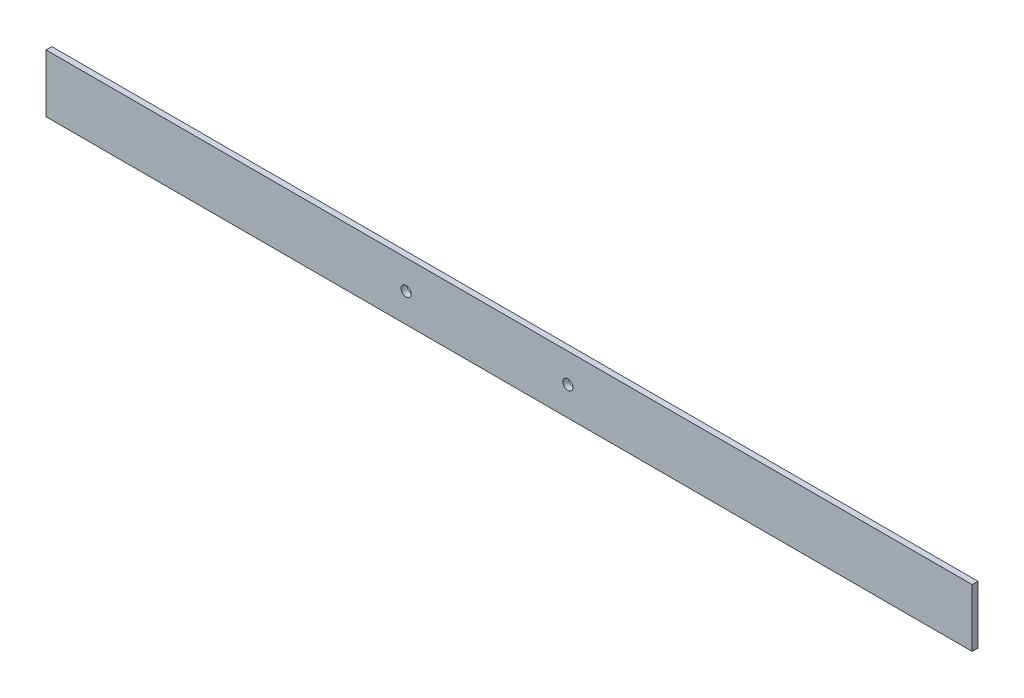
from build123d import *

# Parameters (mm, degrees)
SZKIC1_W                    = 400
SZKIC1_H                    = 50
SZKIC1_R                    = 4.365
DODANIE_WYCI_GNI_CIE1_DEPTH = 5


with BuildPart() as part:
    # Szkic1 → Dodanie-wyciągnięcie1 (new body)
    # profile 1 of 2: a face of its own
    with BuildSketch(Plane.XY):
        with Locations((200, 25)):
            Rectangle(SZKIC1_W, SZKIC1_H)
        with Locations((311.1, 25)):
            Circle(SZKIC1_R, mode=Mode.SUBTRACT)
    # profile 2 of 2: a face of its own
    with BuildSketch(Plane.XY):
        with Locations((600, 25)):
            Rectangle(SZKIC1_W, SZKIC1_H)
        with Locations((450.8, 25)):
            Circle(SZKIC1_R, mode=Mode.SUBTRACT)
    extrude(amount=DODANIE_WYCI_GNI_CIE1_DEPTH)


solid = part.part
